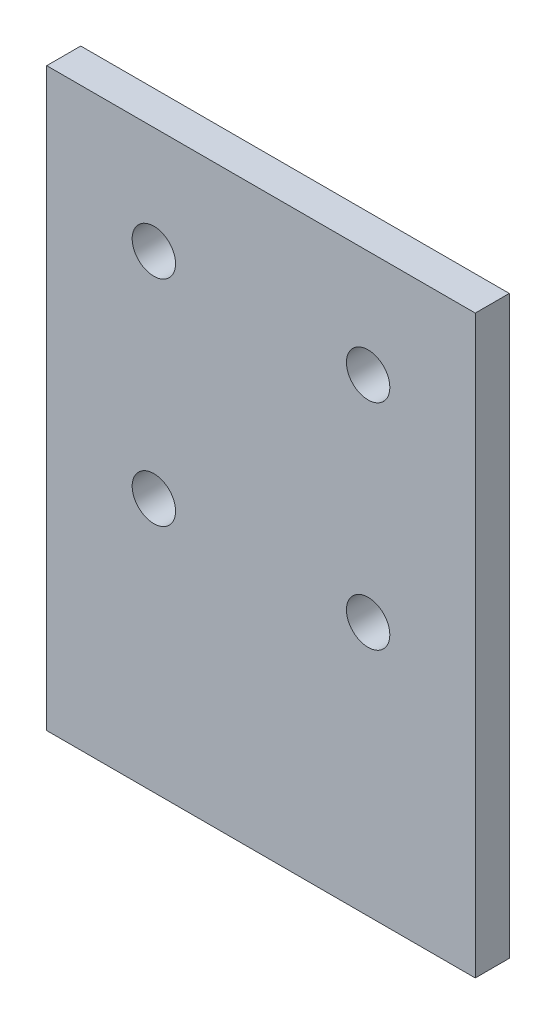
from build123d import *

# Parameters (mm, degrees)
SKETCH1_W           = 80
SKETCH1_H           = 107.5
SKETCH1_R           = 4.05
BOSS_EXTRUDE1_DEPTH = 6.35


with BuildPart() as part:
    # Sketch1 → Boss-Extrude1 (new body)
    with BuildSketch(Plane.XY):
        with Locations((0, -13.75)):
            Rectangle(SKETCH1_W, SKETCH1_H)
        with Locations((-20, 20)):
            Circle(SKETCH1_R, mode=Mode.SUBTRACT)
        with Locations((20, 20)):
            Circle(SKETCH1_R, mode=Mode.SUBTRACT)
        with Locations((20, -20)):
            Circle(SKETCH1_R, mode=Mode.SUBTRACT)
        with Locations((-20, -20)):
            Circle(SKETCH1_R, mode=Mode.SUBTRACT)
    extrude(amount=BOSS_EXTRUDE1_DEPTH)


solid = part.part
